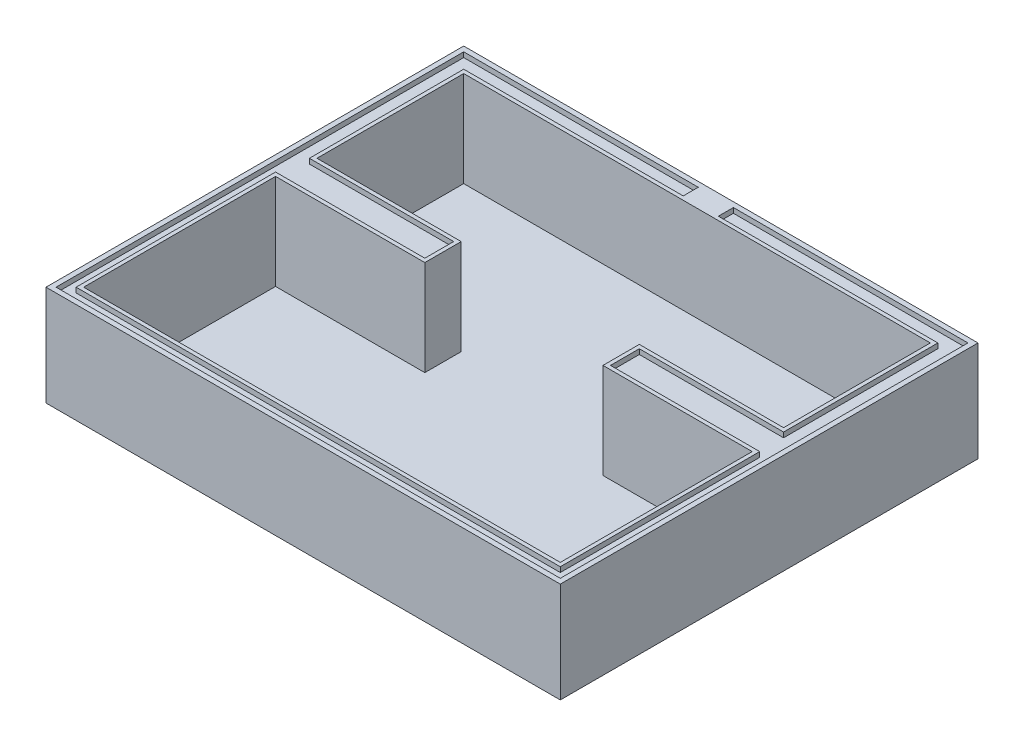
from build123d import *

# Parameters (mm, degrees)
SKETCH1_W           = 205
SKETCH1_H           = 166.5
BOSS_EXTRUDE1_DEPTH = 20
CUT_EXTRUDE1_DEPTH  = 2
CUT_EXTRUDE3_DEPTH  = 38


with BuildPart() as part:
    # Sketch1 → Boss-Extrude1 (new, symmetric)
    with BuildSketch(Plane(origin=(0, 0, 0), x_dir=(1, 0, 0), z_dir=(0, 1, 0))):
        Rectangle(SKETCH1_W, SKETCH1_H)
    extrude(amount=BOSS_EXTRUDE1_DEPTH, both=True)

    # Sketch3 → Cut-Extrude1 (cut)
    # profile 1 of 4: a face of its own
    with BuildSketch(Plane(origin=(0, 20, 0), x_dir=(1, 0, 0), z_dir=(0, 1, 0))):
        Polygon((-100.5, -81.25), (-100.5, 5.75), (-100.5, 81.25), (-7, 81.25), (-7, 75.25), (-94.5, 75.25), (-94.5, 13.75), (-37, 13.75), (-37, 5.75), (-37, 2.25), (-96.5, 2.25), (-96.5, -77.25), (96.5, -77.25), (96.5, 2.25), (37, 2.25), (37, 5.75), (37, 13.75), (94.5, 13.75), (94.5, 75.25), (7, 75.25), (7, 81.25), (100.5, 81.25), (100.5, 5.75), (100.5, -81.25), align=None)
        Polygon((7.5, 80.75), (100, 80.75), (100, 5.75), (100, -80.75), (-100, -80.75), (-100, 5.75), (-100, 80.75), (-7.5, 80.75), (-7.5, 75.75), (-95, 75.75), (-95, 13.25), (-37.5, 13.25), (-37.5, 5.75), (-37.5, 2.75), (-97, 2.75), (-97, -77.75), (97, -77.75), (97, 2.75), (37.5, 2.75), (37.5, 5.75), (37.5, 13.25), (95, 13.25), (95, 75.75), (7.5, 75.75), align=None, mode=Mode.SUBTRACT)
    # profile 2 of 4: a face of its own
    with BuildSketch(Plane(origin=(0, 20, 0), x_dir=(1, 0, 0), z_dir=(0, 1, 0))):
        Polygon((-100, -80.75), (-100, 5.75), (-37.5, 5.75), (-37.5, 2.75), (-97, 2.75), (-97, -77.75), (97, -77.75), (97, 2.75), (37.5, 2.75), (37.5, 5.75), (100, 5.75), (100, -80.75), align=None)
    # profile 3 of 4: a face of its own
    with BuildSketch(Plane(origin=(0, 20, 0), x_dir=(1, 0, 0), z_dir=(0, 1, 0))):
        Polygon((-95, 13.25), (-37.5, 13.25), (-37.5, 5.75), (-100, 5.75), (-100, 80.75), (-7.5, 80.75), (-7.5, 75.75), (-95, 75.75), align=None)
    # profile 4 of 4: a face of its own
    with BuildSketch(Plane(origin=(0, 20, 0), x_dir=(1, 0, 0), z_dir=(0, 1, 0))):
        Polygon((100, 80.75), (100, 5.75), (37.5, 5.75), (37.5, 13.25), (95, 13.25), (95, 75.75), (7.5, 75.75), (7.5, 80.75), align=None)
    extrude(amount=-CUT_EXTRUDE1_DEPTH, mode=Mode.SUBTRACT)

    # Sketch5 → Cut-Extrude3 (cut)
    with BuildSketch(Plane(origin=(0, 20, 0), x_dir=(1, 0, 0), z_dir=(0, 1, 0))):
        Polygon((-7, 73.75), (7, 73.75), (93, 73.75), (93, 15.25), (35.5, 15.25), (35.5, 0.75), (95, 0.75), (95, -75.75), (-95, -75.75), (-95, 0.75), (-35.5, 0.75), (-35.5, 15.25), (-93, 15.25), (-93, 73.75), align=None)
    extrude(amount=-CUT_EXTRUDE3_DEPTH, mode=Mode.SUBTRACT)


solid = part.part
